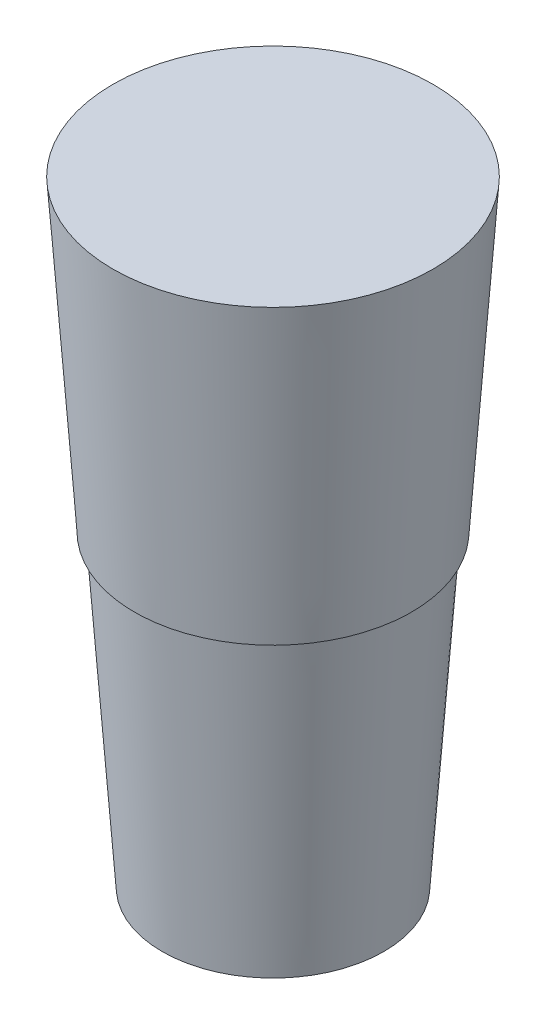
from build123d import *


with BuildPart() as part:
    # Sketch1 → Revolve1 (revolve)
    with BuildSketch(Plane.XY, mode=Mode.PRIVATE) as revolve1_sk:
        Polygon((42.030450172, -40.615447347), (64.890450172, -40.615447347), (69.335452035, 22.884552653), (70.605448309, 22.884552653), (75.050450172, 86.384552653), (42.030450172, 86.384552653), align=None)
    revolve(revolve1_sk.sketch.rotate(Axis((42.030450172, -40.615447347, 0), (0, 1, 0)), 90), axis=Axis((42.030450172, -40.615447347, 0), (0, 1, 0)))


solid = part.part
